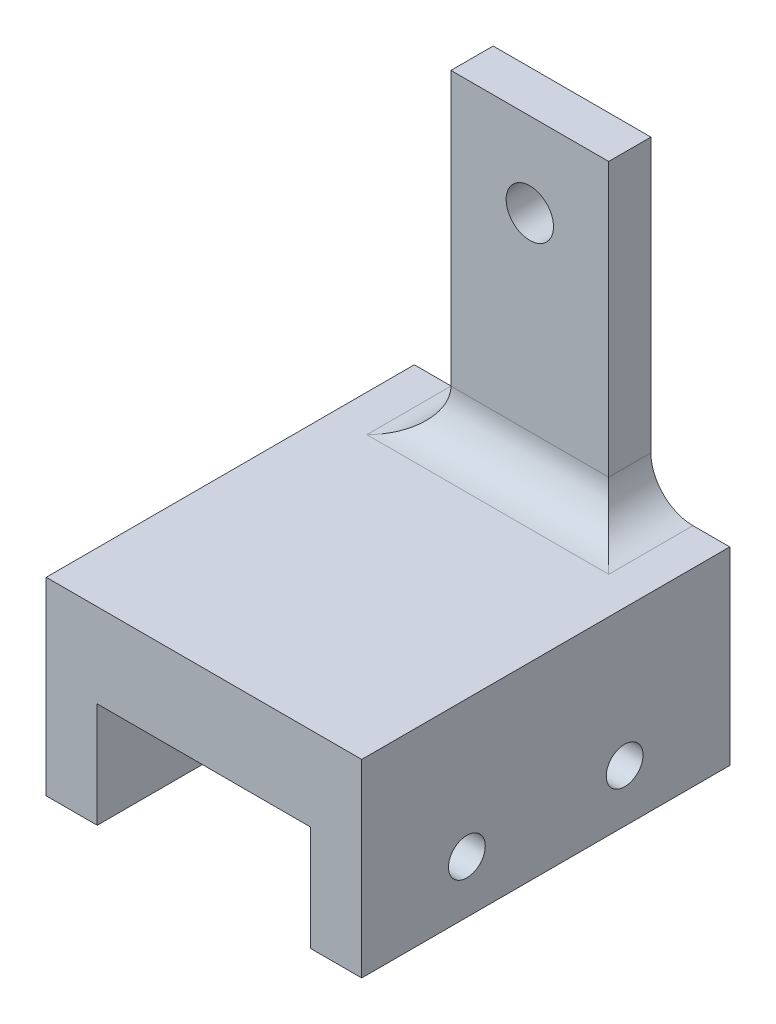
from build123d import *

# Parameters (mm, degrees)
CROQUIS1_W                 = 30
CROQUIS1_H                 = 30
SALIENTE_EXTRUIR1_DEPTH    = 7
CROQUIS2_W                 = 30
CROQUIS2_H                 = 35
SALIENTE_EXTRUIR2_DEPTH    = 8
CROQUIS3_W                 = 4.85
CROQUIS3_H                 = 35
SALIENTE_EXTRUIR3_DEPTH    = 10
CORTAR_EXTRUIR1_REACH      = 47.804
CROQUIS4_R                 = 2.25
CORTAR_EXTRUIR4_REACH      = 47.804
CROQUIS7_W                 = 30
CROQUIS7_H                 = 30
CROQUIS8_W                 = 15
CROQUIS8_H                 = 4.016004192
SALIENTE_EXTRUIR4_DEPTH    = 30
CORTAR_EXTRUIR5_REACH      = 49.687
CROQUIS9_R                 = 2.25
REDONDEO3_R                = 4
CORTAR_EXTRUIR6_DEPTH      = 55.281880034
CORTAR_EXTRUIR6_DEPTH_BACK = 55.281880034
CROQUIS10_R                = 1.75


with BuildPart() as part:
    # Croquis1 → Saliente-Extruir1 (new body)
    with BuildSketch(Plane.XY):
        Rectangle(CROQUIS1_W, CROQUIS1_H)
    extrude(amount=SALIENTE_EXTRUIR1_DEPTH)

    # Croquis2 → Saliente-Extruir2 (add)
    with BuildSketch(Plane.XZ.offset(15)):
        with Locations((0, 17.5)):
            Rectangle(CROQUIS2_W, CROQUIS2_H)
    extrude(amount=SALIENTE_EXTRUIR2_DEPTH)

    # Croquis3 → Saliente-Extruir3 (add)
    with BuildSketch(Plane(origin=(0, -23, 0), x_dir=(-1, 0, 0), z_dir=(0, -1, 0))):
        with Locations((12.575, -17.5)):
            Rectangle(CROQUIS3_W, CROQUIS3_H)
        with Locations((-12.575, -17.5)):
            Rectangle(CROQUIS3_W, CROQUIS3_H)
    extrude(amount=SALIENTE_EXTRUIR3_DEPTH)

    # Croquis4 → Cortar-Extruir1 (cut, up to next)
    with BuildSketch(Plane.XY.offset(7), mode=Mode.PRIVATE) as cortar_extruir1_sk1:
        with Locations((0, 7)):
            Circle(CROQUIS4_R)
    cortar_extruir1_tool1 = extrude(cortar_extruir1_sk1.sketch, amount=-CORTAR_EXTRUIR1_REACH, mode=Mode.PRIVATE) & part.part
    add(cortar_extruir1_tool1.solids().sort_by_distance((0, 7, 7))[0], mode=Mode.SUBTRACT)

    # Croquis7 → Cortar-Extruir4 (cut, up to next)
    with BuildSketch(Plane.XY.offset(7), mode=Mode.PRIVATE) as cortar_extruir4_sk1:
        Rectangle(CROQUIS7_W, CROQUIS7_H)
    cortar_extruir4_tool1 = extrude(cortar_extruir4_sk1.sketch, amount=-CORTAR_EXTRUIR4_REACH, mode=Mode.PRIVATE) & part.part
    add(cortar_extruir4_tool1.solids().sort_by_distance((0, 0, 7))[0], mode=Mode.SUBTRACT)

    # Croquis8 → Saliente-Extruir4 (add)
    with BuildSketch(Plane(origin=(0, -15, 0), x_dir=(1, 0, 0), z_dir=(0, 1, 0))):
        with Locations((0, -2.008002096)):
            Rectangle(CROQUIS8_W, CROQUIS8_H)
    extrude(amount=SALIENTE_EXTRUIR4_DEPTH)

    # Croquis9 → Cortar-Extruir5 (cut, up to next)
    with BuildSketch(Plane.XY.offset(4.016004192), mode=Mode.PRIVATE) as cortar_extruir5_sk1:
        with Locations((0, 7)):
            Circle(CROQUIS9_R)
    cortar_extruir5_tool1 = extrude(cortar_extruir5_sk1.sketch, amount=-CORTAR_EXTRUIR5_REACH, mode=Mode.PRIVATE) & part.part
    add(cortar_extruir5_tool1.solids().sort_by_distance((0, 7, 4.016004))[0], mode=Mode.SUBTRACT)

    # Redondeo3
    redondeo3_edges = [part.edges().sort_by_distance(p)[0] for p in [
        (7.5, -15, 2.008002096),
        (-7.5, -15, 2.008002096),
        (0, -15, 4.016004192),
    ]]
    fillet(redondeo3_edges, radius=REDONDEO3_R)

    # Croquis10 → Cortar-Extruir6 (cut, two sides: drawn at the far end of the back side and taken through both)
    with BuildSketch(Plane(origin=(-10.15, 0, 0), x_dir=(0, 0, -1), z_dir=(1, 0, 0)).offset(-CORTAR_EXTRUIR6_DEPTH_BACK)):
        with Locations((-10, -28)):
            Circle(CROQUIS10_R)
        with Locations((-25, -28)):
            Circle(CROQUIS10_R)
    extrude(amount=CORTAR_EXTRUIR6_DEPTH + CORTAR_EXTRUIR6_DEPTH_BACK, mode=Mode.SUBTRACT)


solid = part.part
